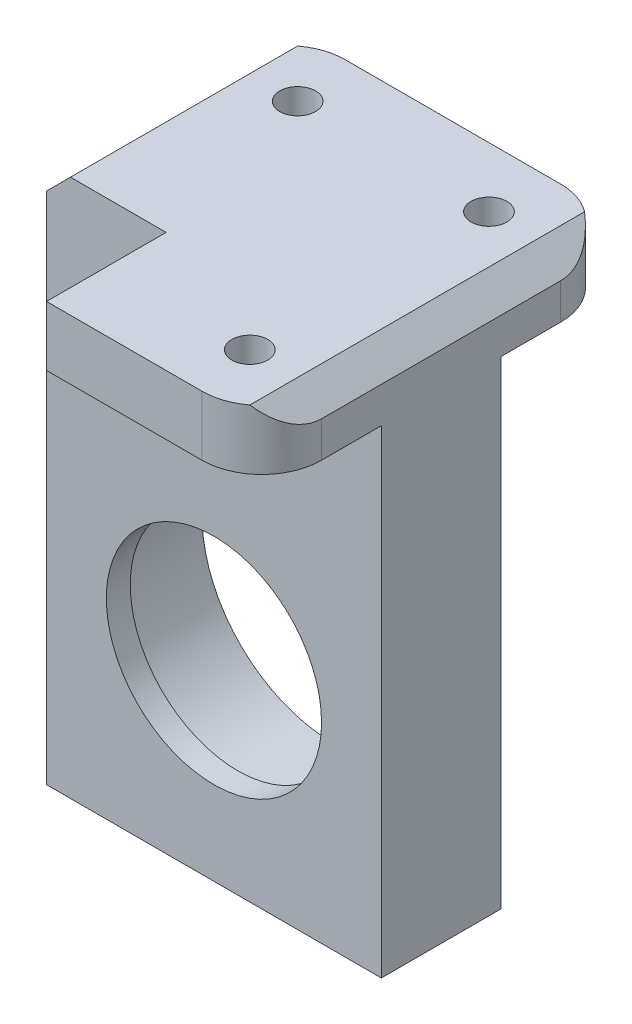
from build123d import *

# Parameters (mm, degrees)
CROQUIS1_W              = 45
CROQUIS1_H              = 28
CROQUIS1_R              = 11
SALIENTE_EXTRUIR1_DEPTH = 10
SALIENTE_EXTRUIR2_START = -2
CROQUIS2_R              = 11
CROQUIS2_R_2            = 9
SALIENTE_EXTRUIR2_DEPTH = 2
CROQUIS3_R              = 1.5
SALIENTE_EXTRUIR3_DEPTH = 5
CORTAR_EXTRUIR1_REACH   = 46.011
CORTAR_EXTRUIR2_REACH   = 53.196
CROQUIS5_W              = 10
CROQUIS5_H              = 10


with BuildPart() as part:
    # Croquis1 → Saliente-Extruir1 (new body)
    with BuildSketch(Plane(origin=(0, 0, 0), x_dir=(0, 1, 0), z_dir=(0, 0, 1))):
        with Locations((6.5, 0)):
            Rectangle(CROQUIS1_W, CROQUIS1_H)
        with Locations(Location((0, 0, 0), (0, 0, 270))):
            Circle(CROQUIS1_R, mode=Mode.SUBTRACT)
    extrude(amount=SALIENTE_EXTRUIR1_DEPTH)

    # Croquis2 → Saliente-Extruir2 (add)
    with BuildSketch(Plane.XY.offset(10).offset(SALIENTE_EXTRUIR2_START)):
        Circle(CROQUIS2_R)
        Circle(CROQUIS2_R_2, mode=Mode.SUBTRACT)
    extrude(amount=SALIENTE_EXTRUIR2_DEPTH)

    # Croquis3 → Saliente-Extruir3 (add)
    # profile 1 of 2: a face of its own
    with BuildSketch(Plane(origin=(0, 29, 0), x_dir=(1, 0, 0), z_dir=(0, 1, 0))):
        with BuildLine():
            Line((-9, -20), (9, -20))
            ThreePointArc((9, -20), (12.535533906, -18.535533906), (14, -15))
            Line((14, -15), (14, -10))
            Line((14, -10), (-14, -10))
            Line((-14, -10), (-14, -15))
            ThreePointArc((-14, -15), (-12.535533906, -18.535533906), (-9, -20))
        make_face()
        with Locations(Location((8, -15, 0), (0, 0, 180))):
            Circle(CROQUIS3_R, mode=Mode.SUBTRACT)
        with Locations((-8, -15)):
            Circle(CROQUIS3_R, mode=Mode.SUBTRACT)
    # profile 2 of 2: a face of its own
    with BuildSketch(Plane(origin=(0, 29, 0), x_dir=(1, 0, 0), z_dir=(0, 1, 0))):
        with BuildLine():
            Line((-14, 0), (14, 0))
            Line((14, 0), (14, 5))
            ThreePointArc((14, 5), (12.535533906, 8.535533906), (9, 10))
            Line((9, 10), (-9, 10))
            ThreePointArc((-9, 10), (-12.535533906, 8.535533906), (-14, 5))
            Line((-14, 5), (-14, 0))
        make_face()
        with Locations(Location((-8, 5, 0), (0, 0, 180))):
            Circle(CROQUIS3_R, mode=Mode.SUBTRACT)
        with Locations((8, 5)):
            Circle(CROQUIS3_R, mode=Mode.SUBTRACT)
    extrude(amount=-SALIENTE_EXTRUIR3_DEPTH)

    # Croquis4 → Cortar-Extruir1 (cut, up to next)
    with BuildSketch(Plane.XY.offset(20), mode=Mode.PRIVATE) as cortar_extruir1_sk1:
        Polygon((12, 29), (14, 27), (14, 29), align=None)
    cortar_extruir1_tool1 = extrude(cortar_extruir1_sk1.sketch, amount=-CORTAR_EXTRUIR1_REACH, mode=Mode.PRIVATE) & part.part
    # Croquis4 → Cortar-Extruir1 (cut, up to next)
    with BuildSketch(Plane.XY.offset(20), mode=Mode.PRIVATE) as cortar_extruir1_sk2:
        Polygon((-14, 27), (-14, 29), (-12, 29), align=None)
    cortar_extruir1_tool2 = extrude(cortar_extruir1_sk2.sketch, amount=-CORTAR_EXTRUIR1_REACH, mode=Mode.PRIVATE) & part.part
    add(cortar_extruir1_tool1.solids().sort_by_distance((13.333333, 28.333333, 20))[0], mode=Mode.SUBTRACT)
    add(cortar_extruir1_tool2.solids().sort_by_distance((-13.333333, 28.333333, 20))[0], mode=Mode.SUBTRACT)

    # Croquis5 → Cortar-Extruir2 (cut, up to next)
    with BuildSketch(Plane(origin=(0, 29, 0), x_dir=(1, 0, 0), z_dir=(0, 1, 0)), mode=Mode.PRIVATE) as cortar_extruir2_sk1:
        with Locations((-9, -15)):
            Rectangle(CROQUIS5_W, CROQUIS5_H)
    cortar_extruir2_tool1 = extrude(cortar_extruir2_sk1.sketch, amount=-CORTAR_EXTRUIR2_REACH, mode=Mode.PRIVATE) & part.part
    add(cortar_extruir2_tool1.solids().sort_by_distance((-9, 29, 15))[0], mode=Mode.SUBTRACT)


solid = part.part
